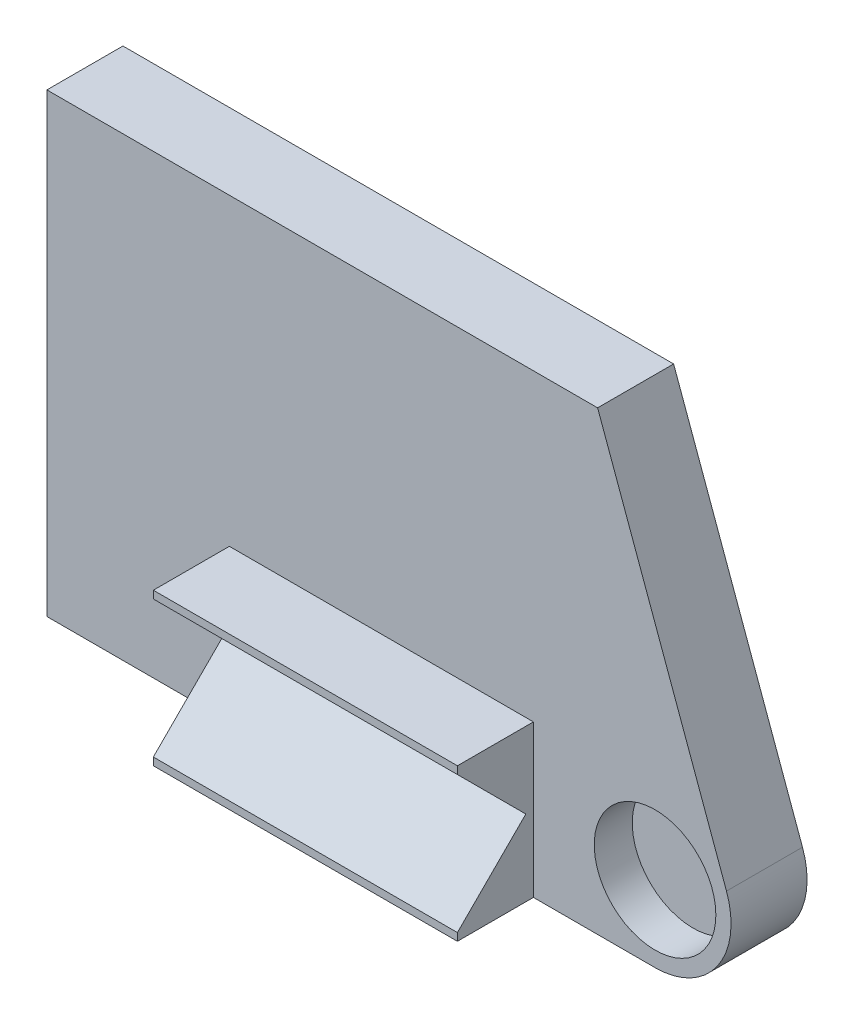
from build123d import *

# Parameters (mm, degrees)
SKETCH_1_R          = 5
EXTRUDE_1_DEPTH     = 5
SKETCH_2_R          = 4
CUT_EXTRUDE_1_DEPTH = 2.5
SKETCH_3_W          = 32
SKETCH_3_H          = 10
EXTRUDE_2_DEPTH     = 5
CUT_EXTRUDE_2_DEPTH = 20
SKETCH_5_W          = 12
SKETCH_5_H          = 10
CUT_EXTRUDE_3_DEPTH = 5


with BuildPart() as part:
    # 草图1 → 凸台-拉伸1 (new body)
    with BuildSketch(Plane.XY):
        Circle(SKETCH_1_R)
        with BuildLine():
            Line((-40, -5), (0, -5))
            ThreePointArc((0, -5), (-4.095760221, 2.867882182), (4.698463104, 1.710100717))
            Line((4.698463104, 1.710100717), (-3.778366994, 25))
            Line((-3.778366994, 25), (-40, 25))
            Line((-40, 25), (-40, -5))
        make_face()
    extrude(amount=EXTRUDE_1_DEPTH)

    # 草图2 → 切除-拉伸1 (cut)
    with BuildSketch(Plane.XY.offset(5)):
        Circle(SKETCH_2_R)
    extrude(amount=-CUT_EXTRUDE_1_DEPTH, mode=Mode.SUBTRACT)

    # 草图3 → 凸台-拉伸2 (add)
    with BuildSketch(Plane.XY.offset(5)):
        with Locations((-24, 0)):
            Rectangle(SKETCH_3_W, SKETCH_3_H)
    extrude(amount=EXTRUDE_2_DEPTH)

    # 草图4 → 切除-拉伸2 (cut)
    with BuildSketch(Plane(origin=(-8, 0, 0), x_dir=(0, 0, -1), z_dir=(1, 0, 0))):
        Polygon((-10, 4.5), (-5.5, 0), (-10, -4.5), align=None)
    extrude(amount=-CUT_EXTRUDE_2_DEPTH, mode=Mode.SUBTRACT)

    # 草图5 → 切除-拉伸3 (cut)
    with BuildSketch(Plane.XY.offset(10)):
        with Locations((-34, 0)):
            Rectangle(SKETCH_5_W, SKETCH_5_H)
    extrude(amount=-CUT_EXTRUDE_3_DEPTH, mode=Mode.SUBTRACT)


solid = part.part
